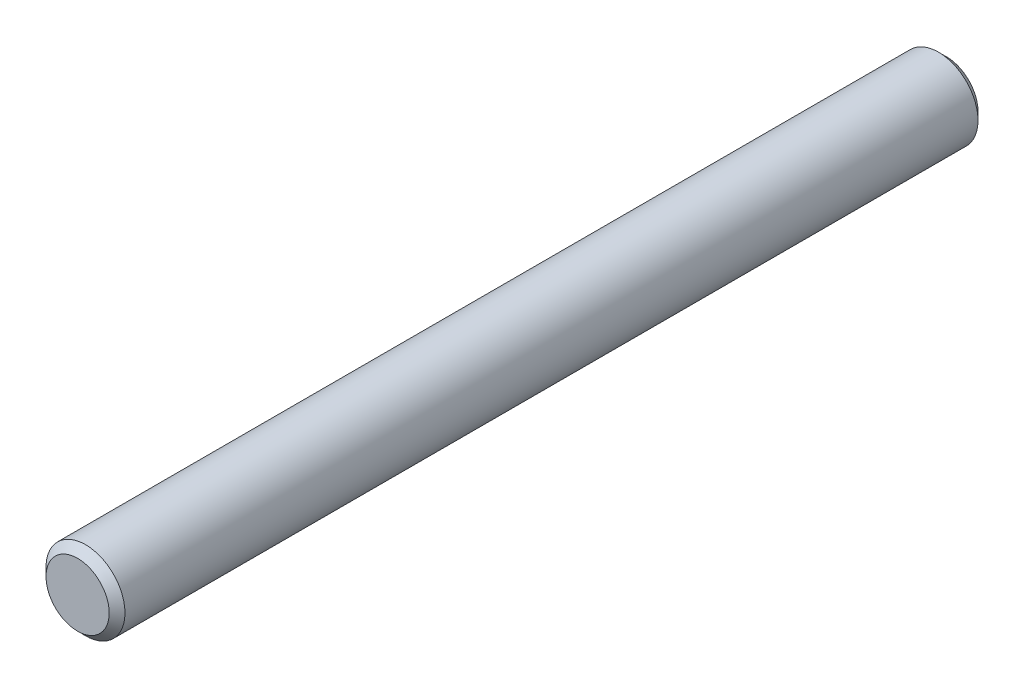
from build123d import *

# Parameters (mm, degrees)
ESBO_O1_R                = 2.5
RESSALTO_EXTRUS_O1_DEPTH = 55
CHANFRO1_SIZE            = 0.5


with BuildPart() as part:
    # Esboço1 → Ressalto-extrusão1 (new body)
    with BuildSketch(Plane.XY):
        Circle(ESBO_O1_R)
    extrude(amount=RESSALTO_EXTRUS_O1_DEPTH)

    # Chanfro1
    chanfro1_edges = [part.edges().sort_by_distance(p)[0] for p in [
        (-2.5, 0, 0),
        (-2.5, 0, 55),
    ]]
    chamfer(chanfro1_edges, length=CHANFRO1_SIZE)


solid = part.part
